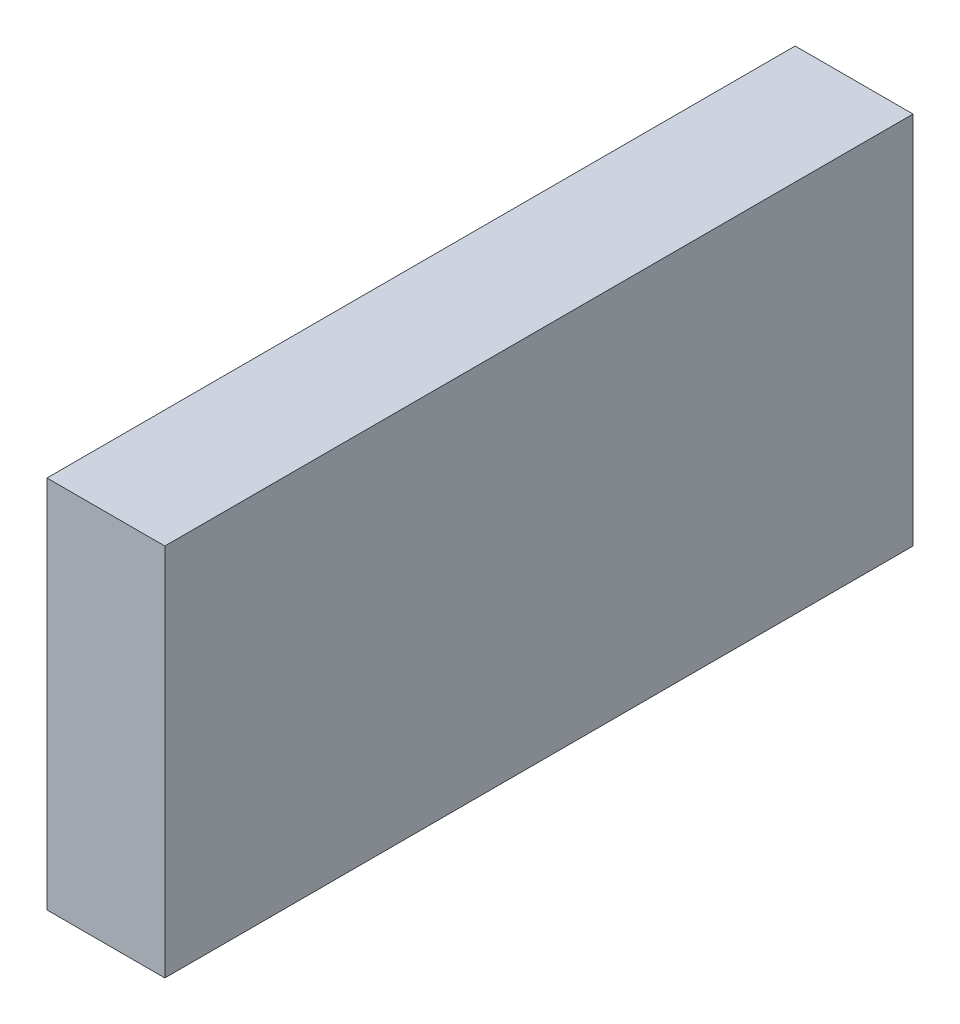
from build123d import *

# Parameters (mm, degrees)
SKETCH1_W           = 40
SKETCH1_H           = 20
BOSS_EXTRUDE1_DEPTH = 6.3


with BuildPart() as part:
    # Sketch1 → Boss-Extrude1 (new body)
    with BuildSketch(Plane(origin=(0, 0, 0), x_dir=(0, 0, -1), z_dir=(1, 0, 0))):
        with Locations((20, 10)):
            Rectangle(SKETCH1_W, SKETCH1_H)
    extrude(amount=BOSS_EXTRUDE1_DEPTH)


solid = part.part
